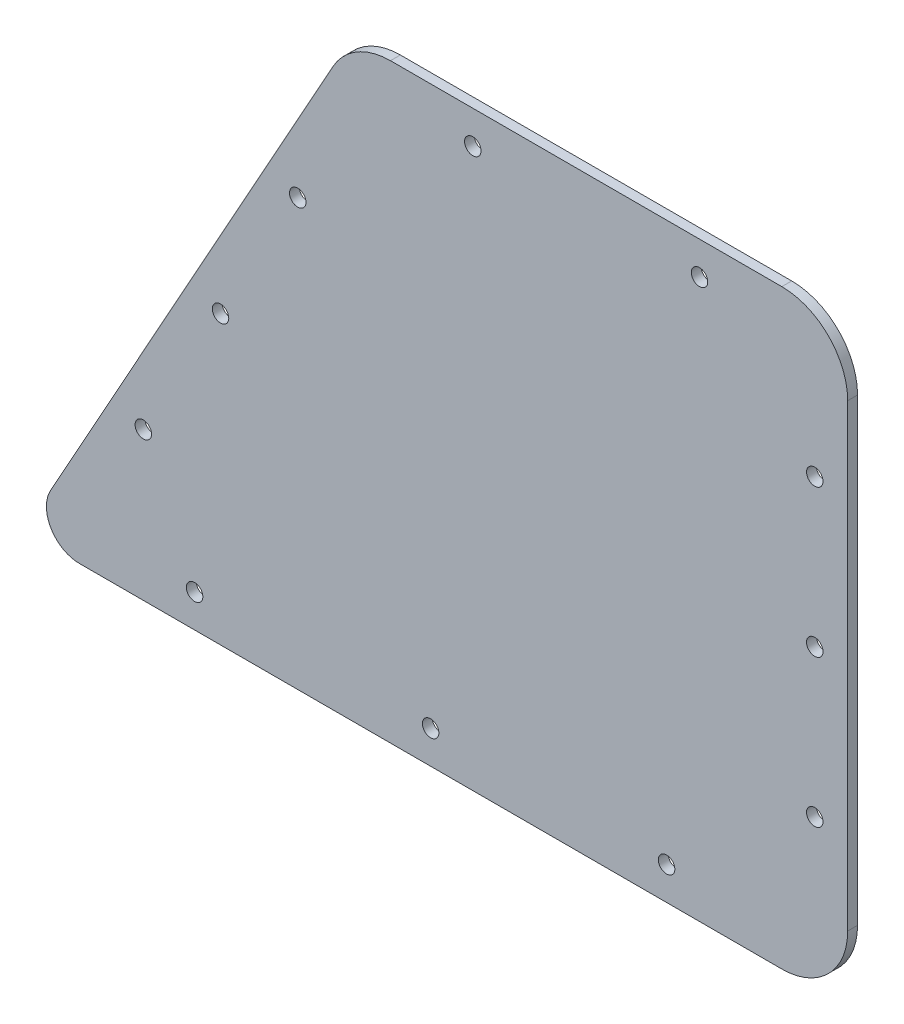
from build123d import *

# Parameters (mm, degrees)
BOSS_EXTRUDE1_DEPTH = 3
CUT_EXTRUDE1_REACH  = 245.11
SKETCH2_R           = 2.5


with BuildPart() as part:
    # Sketch1 → Boss-Extrude1 (new body)
    with BuildSketch(Plane.XY):
        with BuildLine():
            Line((-59.436088262, 179.5), (59.436088262, 179.5))
            ThreePointArc((59.436088262, 179.5), (73.578223886, 173.642135624), (79.436088262, 159.5))
            Line((79.436088262, 159.5), (79.436088262, 20))
            ThreePointArc((79.436088262, 20), (73.578223886, 5.857864376), (59.436088262, 0))
            Line((59.436088262, 0), (-153.931232863, 0))
            ThreePointArc((-153.931232863, 0), (-162.549941964, 4.928722701), (-162.672805625, 14.856429312))
            Line((-162.672805625, 14.856429312), (-76.919233785, 169.212858624))
            ThreePointArc((-76.919233785, 169.212858624), (-69.57864286, 176.737418201), (-59.436088262, 179.5))
        make_face()
    extrude(amount=BOSS_EXTRUDE1_DEPTH)

    # Sketch2 → Cut-Extrude1 (cut, up to next)
    with BuildSketch(Plane.XY.offset(3), mode=Mode.PRIVATE) as cut_extrude1_sk1:
        with Locations((-34.436088262, 169.5)):
            Circle(SKETCH2_R)
    cut_extrude1_tool1 = extrude(cut_extrude1_sk1.sketch, amount=-CUT_EXTRUDE1_REACH, mode=Mode.PRIVATE) & part.part
    # Sketch2 → Cut-Extrude1 (cut, up to next)
    with BuildSketch(Plane.XY.offset(3), mode=Mode.PRIVATE) as cut_extrude1_sk2:
        with Locations((34.433911738, 169.5)):
            Circle(SKETCH2_R)
    cut_extrude1_tool2 = extrude(cut_extrude1_sk2.sketch, amount=-CUT_EXTRUDE1_REACH, mode=Mode.PRIVATE) & part.part
    # Sketch2 → Cut-Extrude1 (cut, up to next)
    with BuildSketch(Plane.XY.offset(3), mode=Mode.PRIVATE) as cut_extrude1_sk3:
        with Locations((69.436088262, 134.5)):
            Circle(SKETCH2_R)
    cut_extrude1_tool3 = extrude(cut_extrude1_sk3.sketch, amount=-CUT_EXTRUDE1_REACH, mode=Mode.PRIVATE) & part.part
    # Sketch2 → Cut-Extrude1 (cut, up to next)
    with BuildSketch(Plane.XY.offset(3), mode=Mode.PRIVATE) as cut_extrude1_sk4:
        with Locations((69.436088262, 89.75)):
            Circle(SKETCH2_R)
    cut_extrude1_tool4 = extrude(cut_extrude1_sk4.sketch, amount=-CUT_EXTRUDE1_REACH, mode=Mode.PRIVATE) & part.part
    # Sketch2 → Cut-Extrude1 (cut, up to next)
    with BuildSketch(Plane.XY.offset(3), mode=Mode.PRIVATE) as cut_extrude1_sk5:
        with Locations((69.436088262, 45)):
            Circle(SKETCH2_R)
    cut_extrude1_tool5 = extrude(cut_extrude1_sk5.sketch, amount=-CUT_EXTRUDE1_REACH, mode=Mode.PRIVATE) & part.part
    # Sketch2 → Cut-Extrude1 (cut, up to next)
    with BuildSketch(Plane.XY.offset(3), mode=Mode.PRIVATE) as cut_extrude1_sk6:
        with Locations((24.436088262, 10)):
            Circle(SKETCH2_R)
    cut_extrude1_tool6 = extrude(cut_extrude1_sk6.sketch, amount=-CUT_EXTRUDE1_REACH, mode=Mode.PRIVATE) & part.part
    # Sketch2 → Cut-Extrude1 (cut, up to next)
    with BuildSketch(Plane.XY.offset(3), mode=Mode.PRIVATE) as cut_extrude1_sk7:
        with Locations((-47.243911738, 10)):
            Circle(SKETCH2_R)
    cut_extrude1_tool7 = extrude(cut_extrude1_sk7.sketch, amount=-CUT_EXTRUDE1_REACH, mode=Mode.PRIVATE) & part.part
    # Sketch2 → Cut-Extrude1 (cut, up to next)
    with BuildSketch(Plane.XY.offset(3), mode=Mode.PRIVATE) as cut_extrude1_sk8:
        with Locations((-118.923911738, 10)):
            Circle(SKETCH2_R)
    cut_extrude1_tool8 = extrude(cut_extrude1_sk8.sketch, amount=-CUT_EXTRUDE1_REACH, mode=Mode.PRIVATE) & part.part
    # Sketch2 → Cut-Extrude1 (cut, up to next)
    with BuildSketch(Plane.XY.offset(3), mode=Mode.PRIVATE) as cut_extrude1_sk9:
        with Locations((-134.505515616, 44.966291045)):
            Circle(SKETCH2_R)
    cut_extrude1_tool9 = extrude(cut_extrude1_sk9.sketch, amount=-CUT_EXTRUDE1_REACH, mode=Mode.PRIVATE) & part.part
    # Sketch2 → Cut-Extrude1 (cut, up to next)
    with BuildSketch(Plane.XY.offset(3), mode=Mode.PRIVATE) as cut_extrude1_sk10:
        with Locations((-87.602121323, 129.392400773)):
            Circle(SKETCH2_R)
    cut_extrude1_tool10 = extrude(cut_extrude1_sk10.sketch, amount=-CUT_EXTRUDE1_REACH, mode=Mode.PRIVATE) & part.part
    # Sketch2 → Cut-Extrude1 (cut, up to next)
    with BuildSketch(Plane.XY.offset(3), mode=Mode.PRIVATE) as cut_extrude1_sk11:
        with Locations((-111.05381847, 87.179345909)):
            Circle(SKETCH2_R)
    cut_extrude1_tool11 = extrude(cut_extrude1_sk11.sketch, amount=-CUT_EXTRUDE1_REACH, mode=Mode.PRIVATE) & part.part
    add(cut_extrude1_tool1.solids().sort_by_distance((-34.436088, 169.5, 3))[0], mode=Mode.SUBTRACT)
    add(cut_extrude1_tool2.solids().sort_by_distance((34.433912, 169.5, 3))[0], mode=Mode.SUBTRACT)
    add(cut_extrude1_tool3.solids().sort_by_distance((69.436088, 134.5, 3))[0], mode=Mode.SUBTRACT)
    add(cut_extrude1_tool4.solids().sort_by_distance((69.436088, 89.75, 3))[0], mode=Mode.SUBTRACT)
    add(cut_extrude1_tool5.solids().sort_by_distance((69.436088, 45, 3))[0], mode=Mode.SUBTRACT)
    add(cut_extrude1_tool6.solids().sort_by_distance((24.436088, 10, 3))[0], mode=Mode.SUBTRACT)
    add(cut_extrude1_tool7.solids().sort_by_distance((-47.243912, 10, 3))[0], mode=Mode.SUBTRACT)
    add(cut_extrude1_tool8.solids().sort_by_distance((-118.923912, 10, 3))[0], mode=Mode.SUBTRACT)
    add(cut_extrude1_tool9.solids().sort_by_distance((-134.505516, 44.966291, 3))[0], mode=Mode.SUBTRACT)
    add(cut_extrude1_tool10.solids().sort_by_distance((-87.602121, 129.392401, 3))[0], mode=Mode.SUBTRACT)
    add(cut_extrude1_tool11.solids().sort_by_distance((-111.053818, 87.179346, 3))[0], mode=Mode.SUBTRACT)


solid = part.part
